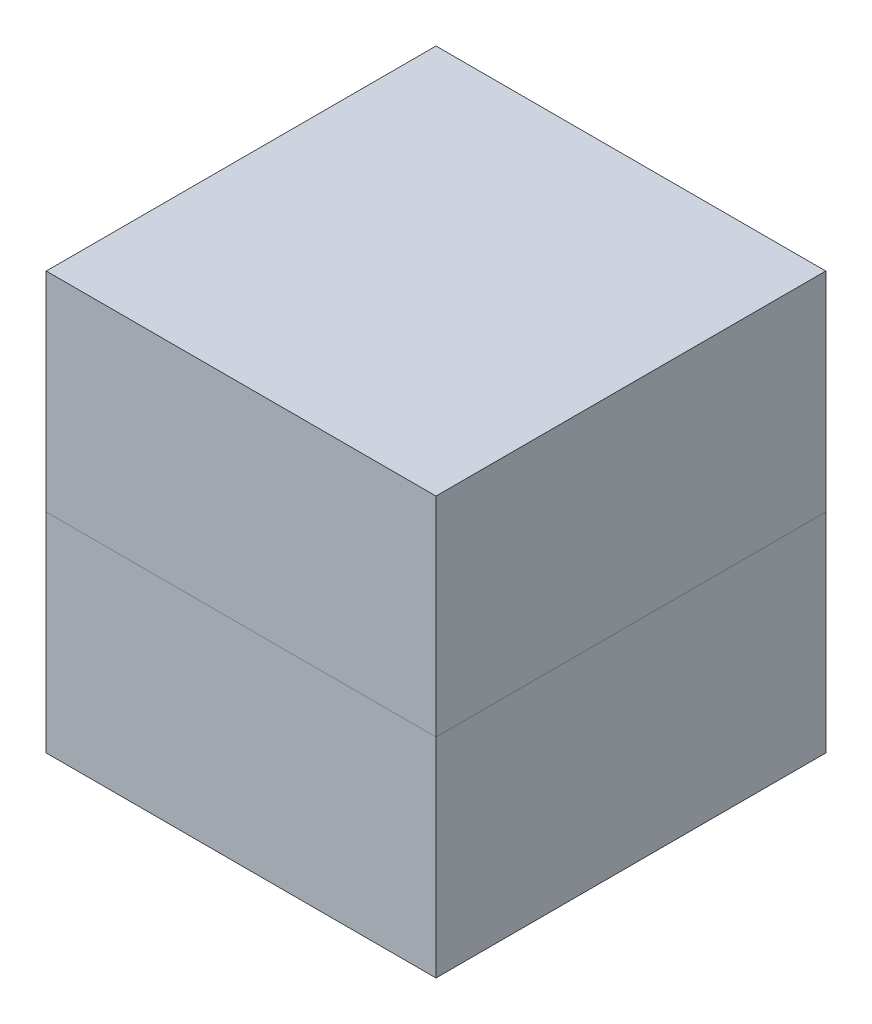
from build123d import *

# Parameters (mm, degrees)
BOSS_EXTRUDE1_DEPTH   = 5.08
BOSS_EXTRUDE1_2_DEPTH = 5.08
BOSS_EXTRUDE1_3_DEPTH = 5.08
BOSS_EXTRUDE1_4_DEPTH = 5.08
SKETCH2_W             = 4.744123862
SKETCH2_H             = 4.744123862
BOSS_EXTRUDE10_DEPTH  = 2.54
SKETCH3_W             = 4.744123862
SKETCH3_H             = 4.744123862
SKETCH3_W_2           = 3.937
SKETCH3_H_2           = 3.937
BOSS_EXTRUDE13_DEPTH  = 2.54


with BuildPart() as part:
    # Sketch1 → Boss-Extrude1 (new body)
    with BuildSketch(Plane(origin=(0, 0, 0), x_dir=(1, 0, 0), z_dir=(0, 1, 0))):
        with BuildLine():
            Line((-1.9685, 1.9685), (-1.9685, 0))
            ThreePointArc((-1.9685, 0), (-1.5113, 0.4572), (-1.0541, 0))
            ThreePointArc((-1.0541, 0), (-0.745361258, 0.745361258), (0, 1.0541))
            ThreePointArc((0, 1.0541), (-0.4572, 1.5113), (0, 1.9685))
            Line((0, 1.9685), (-1.9685, 1.9685))
        make_face()
    extrude(amount=BOSS_EXTRUDE1_DEPTH)


with BuildPart() as body_2:
    # Sketch1 → Boss-Extrude1 2 (new body)
    with BuildSketch(Plane(origin=(0, 0, 0), x_dir=(1, 0, 0), z_dir=(0, 1, 0))):
        with BuildLine():
            Line((1.9685, 1.9685), (0, 1.9685))
            ThreePointArc((0, 1.9685), (0.32328922, 1.83458922), (0.4572, 1.5113))
            ThreePointArc((0.4572, 1.5113), (0.32328922, 1.18801078), (0, 1.0541))
            ThreePointArc((0, 1.0541), (0.745361258, 0.745361258), (1.0541, 0))
            ThreePointArc((1.0541, 0), (1.5113, 0.4572), (1.9685, 0))
            Line((1.9685, 0), (1.9685, 1.9685))
        make_face()
    extrude(amount=BOSS_EXTRUDE1_2_DEPTH)


with BuildPart() as body_3:
    # Sketch1 → Boss-Extrude1 3 (new body)
    with BuildSketch(Plane(origin=(0, 0, 0), x_dir=(1, 0, 0), z_dir=(0, 1, 0))):
        with BuildLine():
            ThreePointArc((0.4572, -1.5113), (0.32328922, -1.83458922), (0, -1.9685))
            Line((0, -1.9685), (1.9685, -1.9685))
            Line((1.9685, -1.9685), (1.9685, 0))
            ThreePointArc((1.9685, 0), (1.5113, -0.4572), (1.0541, 0))
            ThreePointArc((1.0541, 0), (0.745361258, -0.745361258), (0, -1.0541))
            ThreePointArc((0, -1.0541), (0.32328922, -1.18801078), (0.4572, -1.5113))
        make_face()
    extrude(amount=BOSS_EXTRUDE1_3_DEPTH)


with BuildPart() as body_4:
    # Sketch1 → Boss-Extrude1 4 (new body)
    with BuildSketch(Plane(origin=(0, 0, 0), x_dir=(1, 0, 0), z_dir=(0, 1, 0))):
        with BuildLine():
            ThreePointArc((-1.0541, 0), (-1.5113, -0.4572), (-1.9685, 0))
            Line((-1.9685, 0), (-1.9685, -1.9685))
            Line((-1.9685, -1.9685), (0, -1.9685))
            ThreePointArc((0, -1.9685), (-0.4572, -1.5113), (0, -1.0541))
            ThreePointArc((0, -1.0541), (-0.745361258, -0.745361258), (-1.0541, 0))
        make_face()
    extrude(amount=BOSS_EXTRUDE1_4_DEPTH)


with BuildPart() as body_5:
    # Sketch2 → Boss-Extrude10 (new body)
    with BuildSketch(Plane(origin=(0, 5.08, 0), x_dir=(1, 0, 0), z_dir=(0, 1, 0))):
        Rectangle(SKETCH2_W, SKETCH2_H)
    extrude(amount=-BOSS_EXTRUDE10_DEPTH)


with BuildPart() as body_6:
    # Sketch3 → Boss-Extrude13 (new body)
    with BuildSketch(Plane.XZ.offset(-2.54)):
        Rectangle(SKETCH3_W, SKETCH3_H)
        Rectangle(SKETCH3_W_2, SKETCH3_H_2, mode=Mode.SUBTRACT)
    extrude(amount=BOSS_EXTRUDE13_DEPTH)


solid = Compound([part.part, body_2.part, body_3.part, body_4.part, body_5.part, body_6.part])
